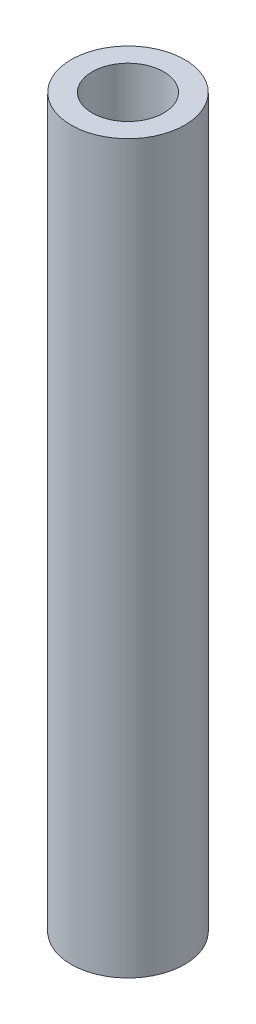
from build123d import *

# Parameters (mm, degrees)
SKETCH1_R           = 3.175
SKETCH1_R_2         = 2
BOSS_EXTRUDE1_DEPTH = 40.64


with BuildPart() as part:
    # Sketch1 → Boss-Extrude1 (new body)
    with BuildSketch(Plane(origin=(0, 0, 0), x_dir=(1, 0, 0), z_dir=(0, 1, 0))):
        with Locations(Location((0, 0, 0), (0, 0, 270))):
            Circle(SKETCH1_R)
        with Locations(Location((0, 0, 0), (0, 0, 270))):
            Circle(SKETCH1_R_2, mode=Mode.SUBTRACT)
    extrude(amount=-BOSS_EXTRUDE1_DEPTH)


solid = part.part
